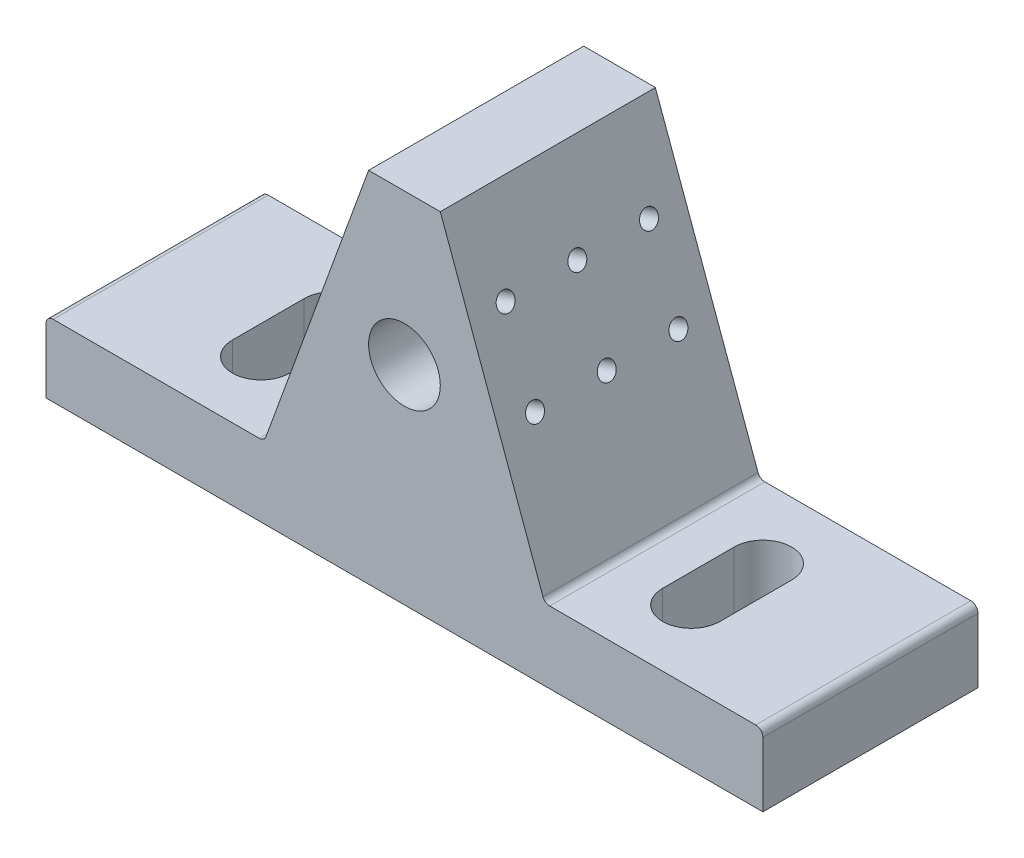
from build123d import *

# Parameters (mm, degrees)
BASE_EXTRUDE_DEPTH   = 15
SLOT_CUT_DEPTH       = 66.76473219
SKETCH3_R            = 5
GUIDE_HOLE_DEPTH     = 77.811457479
LPATTERN1_COUNT      = 3
LPATTERN1_PITCH      = 10
LPATTERN1_COUNT_DIR2 = 2
LPATTERN1_PITCH_DIR2 = 12
FILLET1_R            = 1


with BuildPart() as part:
    # Sketch1 → Base Extrude (new, symmetric)
    with BuildSketch(Plane.XY):
        Polygon((-50, 0), (50, 0), (50, 10), (19.558809371, 10), (5, 50), (-5, 50), (-19.558809371, 10), (-50, 10), align=None)
    extrude(amount=BASE_EXTRUDE_DEPTH, both=True)

    # Sketch2 → Slot Cut (cut, through all)
    with BuildSketch(Plane(origin=(0, 10, 0), x_dir=(1, 0, 0), z_dir=(0, 1, 0))):
        with BuildLine():
            Line((26, -5), (26, 5))
            ThreePointArc((26, 5), (30, 9), (34, 5))
            Line((34, 5), (34, -5))
            ThreePointArc((34, -5), (30, -9), (26, -5))
        make_face()
    slot_cut = extrude(amount=-SLOT_CUT_DEPTH, mode=Mode.SUBTRACT)

    # Mirror1: Slot Cut across plane
    add(slot_cut.mirror(Plane(origin=(0, 0, 0), x_dir=(0, 0, 1), z_dir=(1, 0, 0))), mode=Mode.SUBTRACT)

    # Sketch3 → Guide hole (cut, through all)
    with BuildSketch(Plane.XY.offset(15)):
        with Locations((0, 29)):
            Circle(SKETCH3_R)
    extrude(amount=-GUIDE_HOLE_DEPTH, mode=Mode.SUBTRACT)

    # Sketch10 → M3x0.5 Tapped Hole3 (revolve, cut)
    with BuildSketch(Plane(origin=(13.216501869, 27.425346647, 10), x_dir=(-0.3420201433256727, 0.939692620785907, 0), z_dir=(0, 0, 1))):
        Polygon((0, 0), (0, 8.251075774), (1.25, 7.5), (1.25, 0), align=None)
    m3x0_5_tapped_hole3 = revolve(axis=Axis((19.183550011, 29.597174557, 10), (-0.9396926207859069, -0.34202014332567277, 0)), mode=Mode.SUBTRACT)

    # LPattern1: M3x0.5 Tapped Hole3 3 × 2
    with Locations(*[Vector(0, 0, -1) * (i * LPATTERN1_PITCH) + Vector(-0.34202014332567315, 0.9396926207859069, 0) * (j * LPATTERN1_PITCH_DIR2) for i in range(LPATTERN1_COUNT) for j in range(LPATTERN1_COUNT_DIR2) if (i, j) != (0, 0)]):
        add(m3x0_5_tapped_hole3, mode=Mode.SUBTRACT)

    # Fillet1
    fillet1_edges = [part.edges().sort_by_distance(p)[0] for p in [
        (-50, 10, 0),
        (-19.558809371, 10, 0),
        (19.558809371, 10, 0),
        (50, 10, 0),
    ]]
    fillet(fillet1_edges, radius=FILLET1_R)


solid = part.part
